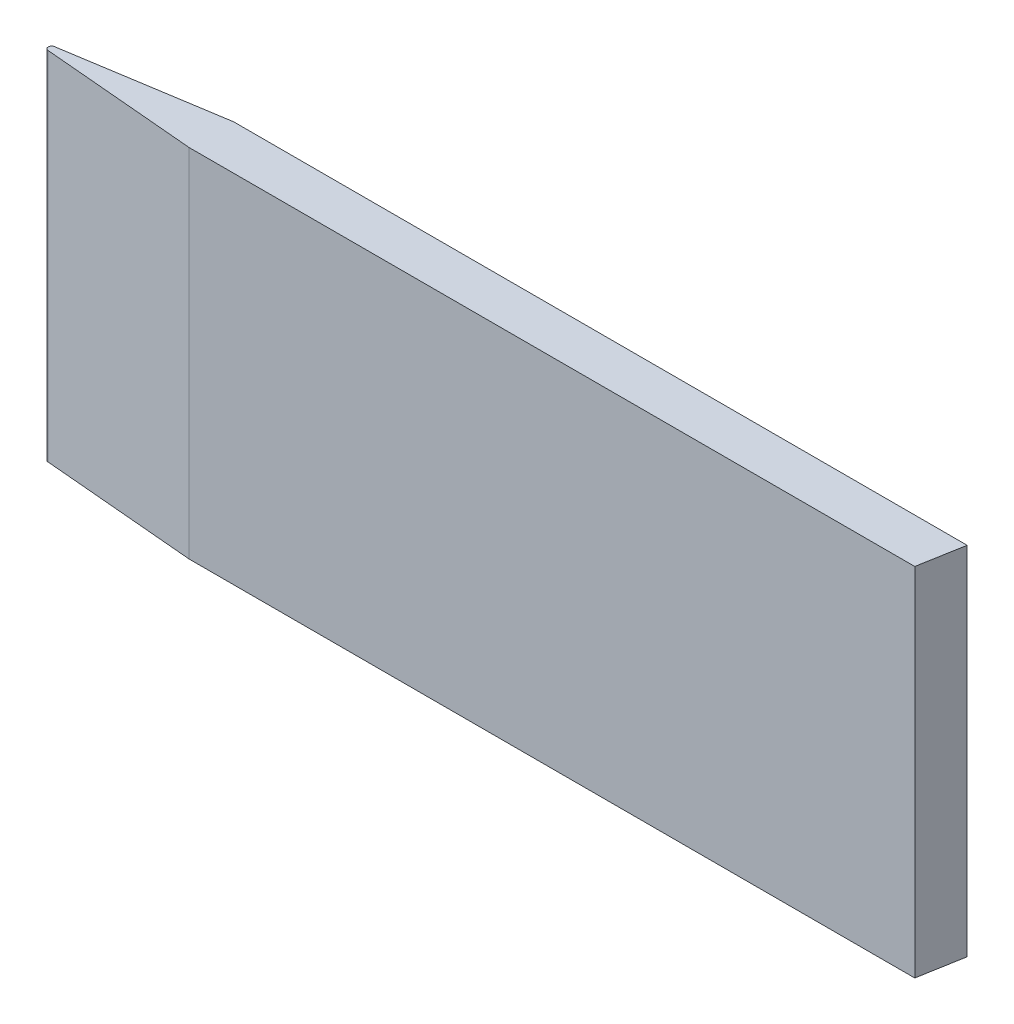
from build123d import *

# Parameters (mm, degrees)
BOSS_EXTRUDE1_DEPTH = 80


with BuildPart() as part:
    # Sketch1 → Boss-Extrude1 (new body)
    with BuildSketch(Plane(origin=(0, 0, 0), x_dir=(1, 0, 0), z_dir=(0, 1, 0))):
        with BuildLine():
            Line((100, 5), (98.236730193, -5))
            Line((98.236730193, -5), (-64.645595971, -5))
            Line((-64.645595971, -5), (-99.406651233, -1.958801732))
            ThreePointArc((-99.406651233, -1.958801732), (-99.829230269, -1.750408814), (-100, -1.311275179))
            Line((-100, -1.311275179), (-100, -1.154739941))
            ThreePointArc((-100, -1.154739941), (-99.844263878, -0.732598709), (-99.451682402, -0.512742519))
            Line((-99.451682402, -0.512742519), (-64.645595971, 5))
            Line((-64.645595971, 5), (100, 5))
        make_face()
    extrude(amount=BOSS_EXTRUDE1_DEPTH)


solid = part.part
